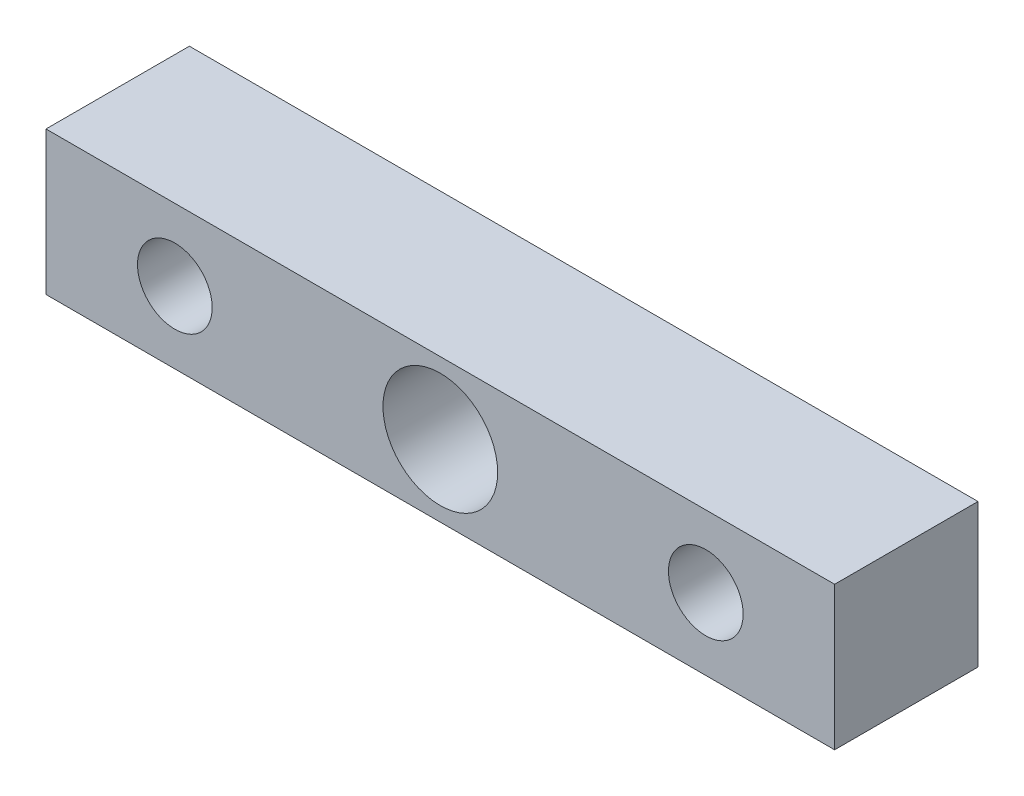
from build123d import *

# Parameters (mm, degrees)
SKETCH_1_W          = 55
SKETCH_1_H          = 10
EXTRUDE_1_DEPTH     = 10
SKETCH_2_R          = 2.605
CUT_EXTRUDE_1_DEPTH = 10
SKETCH_3_R          = 4
CUT_EXTRUDE_2_DEPTH = 10


with BuildPart() as part:
    # 草图1 → 凸台-拉伸1 (new body)
    with BuildSketch(Plane.XY):
        Rectangle(SKETCH_1_W, SKETCH_1_H)
    extrude(amount=EXTRUDE_1_DEPTH)

    # 草图2 → 切除-拉伸1 (cut)
    with BuildSketch(Plane.XY.offset(10)):
        with Locations((18.515, 0)):
            Circle(SKETCH_2_R)
        with Locations((-18.515, 0)):
            Circle(SKETCH_2_R)
    extrude(amount=-CUT_EXTRUDE_1_DEPTH, mode=Mode.SUBTRACT)

    # 草图3 → 切除-拉伸2 (cut)
    with BuildSketch(Plane.XY.offset(10)):
        Circle(SKETCH_3_R)
    extrude(amount=-CUT_EXTRUDE_2_DEPTH, mode=Mode.SUBTRACT)


solid = part.part
